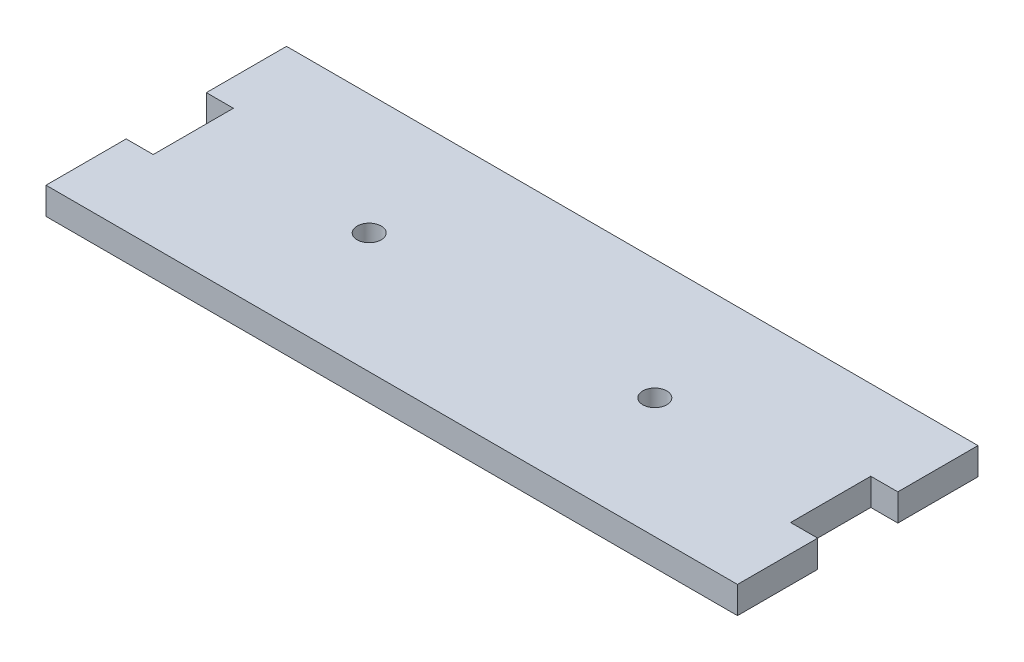
from build123d import *

# Parameters (mm, degrees)
SKETCH1_R           = 4
SKETCH1_W           = 9
SKETCH1_H           = 26.666666667
BOSS_EXTRUDE1_DEPTH = 9


with BuildPart() as part:
    # Sketch1 → Boss-Extrude1 (new body)
    # profile 1 of 5: a face of its own
    with BuildSketch(Plane(origin=(0, 0, 0), x_dir=(1, 0, 0), z_dir=(0, 1, 0))):
        Polygon((9, 26.666666667), (9, 0), (221, 0), (221, 26.666666667), (221, 53.333333333), (221, 80), (9, 80), (9, 53.333333333), align=None)
        with Locations(Location((67.5, 40, 0), (0, 0, 270))):
            Circle(SKETCH1_R, mode=Mode.SUBTRACT)
        with Locations(Location((162.5, 40, 0), (0, 0, 270))):
            Circle(SKETCH1_R, mode=Mode.SUBTRACT)
    # profile 2 of 5: a face of its own
    with BuildSketch(Plane(origin=(0, 0, 0), x_dir=(1, 0, 0), z_dir=(0, 1, 0))):
        with Locations((4.5, 66.666666667)):
            Rectangle(SKETCH1_W, SKETCH1_H)
    # profile 3 of 5: a face of its own
    with BuildSketch(Plane(origin=(0, 0, 0), x_dir=(1, 0, 0), z_dir=(0, 1, 0))):
        with Locations((4.5, 13.333333334)):
            Rectangle(SKETCH1_W, SKETCH1_H)
    # profile 4 of 5: a face of its own
    with BuildSketch(Plane(origin=(0, 0, 0), x_dir=(1, 0, 0), z_dir=(0, 1, 0))):
        with Locations((225.5, 66.666666667)):
            Rectangle(SKETCH1_W, SKETCH1_H)
    # profile 5 of 5: a face of its own
    with BuildSketch(Plane(origin=(0, 0, 0), x_dir=(1, 0, 0), z_dir=(0, 1, 0))):
        with Locations((225.5, 13.333333334)):
            Rectangle(SKETCH1_W, SKETCH1_H)
    extrude(amount=BOSS_EXTRUDE1_DEPTH)


solid = part.part
